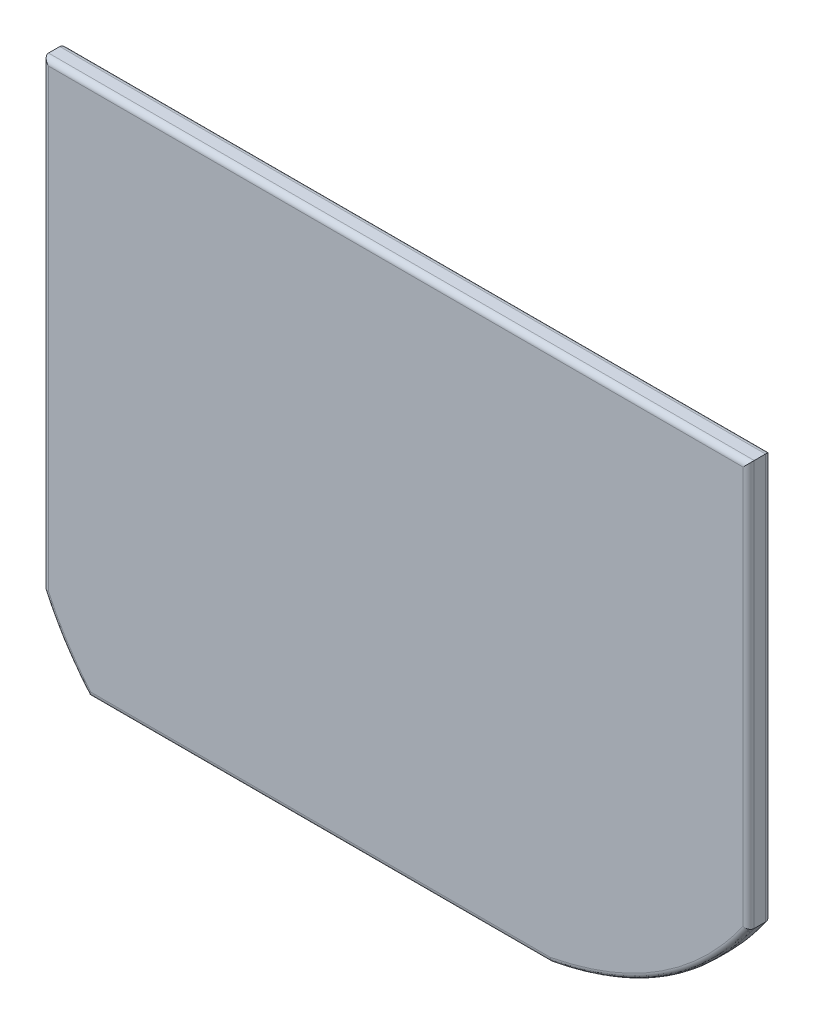
from build123d import *

# Parameters (mm, degrees)
BOSS_EXTRUDE1_DEPTH = 2
FILLET1_R           = 0.5


with BuildPart() as part:
    # Sketch1 → Boss-Extrude1 (new body)
    with BuildSketch(Plane.XY):
        with BuildLine():
            Line((-145.99999999999895, 90.15000000000006), (-83.41298388416027, 90.15000000000006))
            Line((-83.41298388416027, 90.15000000000006), (-83.41298388416027, 54.21061421965468))
            add(Edge.make_bspline(
                [(-100.96466600142944, 42.94885950379533), (-89.79406328434806, 45.090747163384094), (-83.41298388416027, 54.21061421965468)],
                knots=[0, 0, 0, 1, 1, 1], degree=2))
            Line((-100.96466600142944, 42.94885950379533), (-141.9812710492236, 42.94885950379533))
            add(Edge.make_bspline(
                [(-145.99999999999895, 49.20370216177108), (-144.45177140863723, 45.789495610020026), (-141.9812710492236, 42.94885950379533)],
                knots=[0, 0, 0, 1, 1, 1], degree=2))
            Line((-145.99999999999895, 49.20370216177108), (-145.99999999999895, 90.15000000000006))
        make_face()
    extrude(amount=BOSS_EXTRUDE1_DEPTH)

    # Fillet1
    fillet1_edges = [part.edges().sort_by_distance(p)[0] for p in [
        (-121.47296852532652, 42.94885950379533, 2),
        (-91.04467198297803, 46.80118149181579, 2),
        (-83.41298388416027, 72.18030710982737, 2),
        (-114.70649194207961, 90.15000000000006, 2),
        (-145.99999999999895, 69.67685108088557, 2),
        (-114.70649194207961, 90.15000000000006, 0),
        (-83.41298388416027, 72.18030710982737, 0),
        (-91.04467198297803, 46.80118149181579, 0),
        (-121.47296852532652, 42.94885950379533, 0),
        (-144.2190558069609, 45.92954612787242, 0),
        (-145.99999999999895, 69.67685108088557, 0),
        (-144.2190558069609, 45.92954612787242, 2),
    ]]
    fillet(fillet1_edges, radius=FILLET1_R)


solid = part.part
